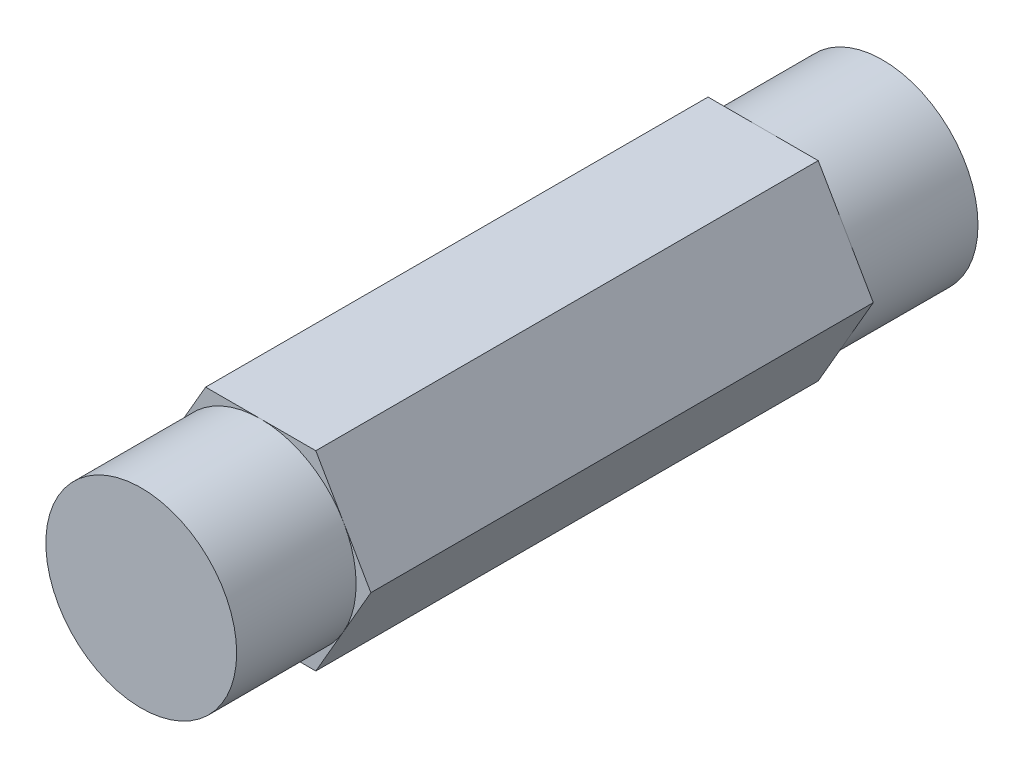
from build123d import *

# Parameters (mm, degrees)
BOSS_EXTRUDE1_DEPTH = 24.66975
SKETCH4_OUTSIDE_W   = 27.268
SKETCH4_OUTSIDE_H   = 25.304
SKETCH4_OUTSIDE_R   = 6.35
CUT_EXTRUDE2_DEPTH  = 7.9502


with BuildPart() as part:
    # Sketch1 → Boss-Extrude1 (new, symmetric)
    with BuildSketch(Plane.XY):
        Polygon((7.332348419, 0), (3.666174209, 6.35), (-3.666174209, 6.35), (-7.332348419, 0), (-3.666174209, -6.35), (3.666174209, -6.35), align=None)
    extrude(amount=BOSS_EXTRUDE1_DEPTH, both=True)

    # Sketch4 outside → Cut-Extrude2 (cut)
    with BuildSketch(Plane.XY.offset(24.66975)):
        Rectangle(SKETCH4_OUTSIDE_W, SKETCH4_OUTSIDE_H)
        Circle(SKETCH4_OUTSIDE_R, mode=Mode.SUBTRACT)
    cut_extrude2 = extrude(amount=-CUT_EXTRUDE2_DEPTH, mode=Mode.SUBTRACT)

    # Mirror1: Cut-Extrude2 across plane
    add(cut_extrude2.mirror(Plane.XY), mode=Mode.SUBTRACT)


solid = part.part
